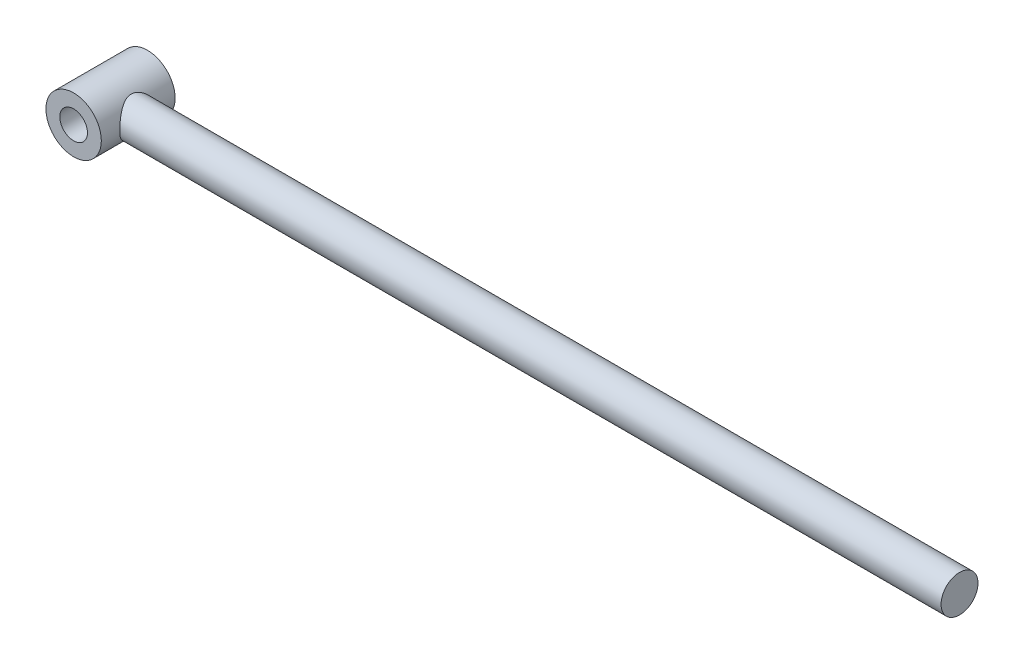
from build123d import *

# Parameters (mm, degrees)
SKETCH1_R           = 30
SKETCH1_R_2         = 15
BOSS_EXTRUDE1_DEPTH = 40
SKETCH2_R           = 20
BOSS_EXTRUDE2_DEPTH = 900


with BuildPart() as part:
    # Sketch1 → Boss-Extrude1 (new, symmetric)
    with BuildSketch(Plane.XY):
        Circle(SKETCH1_R)
        Circle(SKETCH1_R_2, mode=Mode.SUBTRACT)
    extrude(amount=BOSS_EXTRUDE1_DEPTH, both=True)

    # Sketch2 → Boss-Extrude2 (add)
    with BuildSketch(Plane(origin=(20, 0, 0), x_dir=(0, 0, -1), z_dir=(1, 0, 0))):
        Circle(SKETCH2_R)
    extrude(amount=BOSS_EXTRUDE2_DEPTH)


solid = part.part
